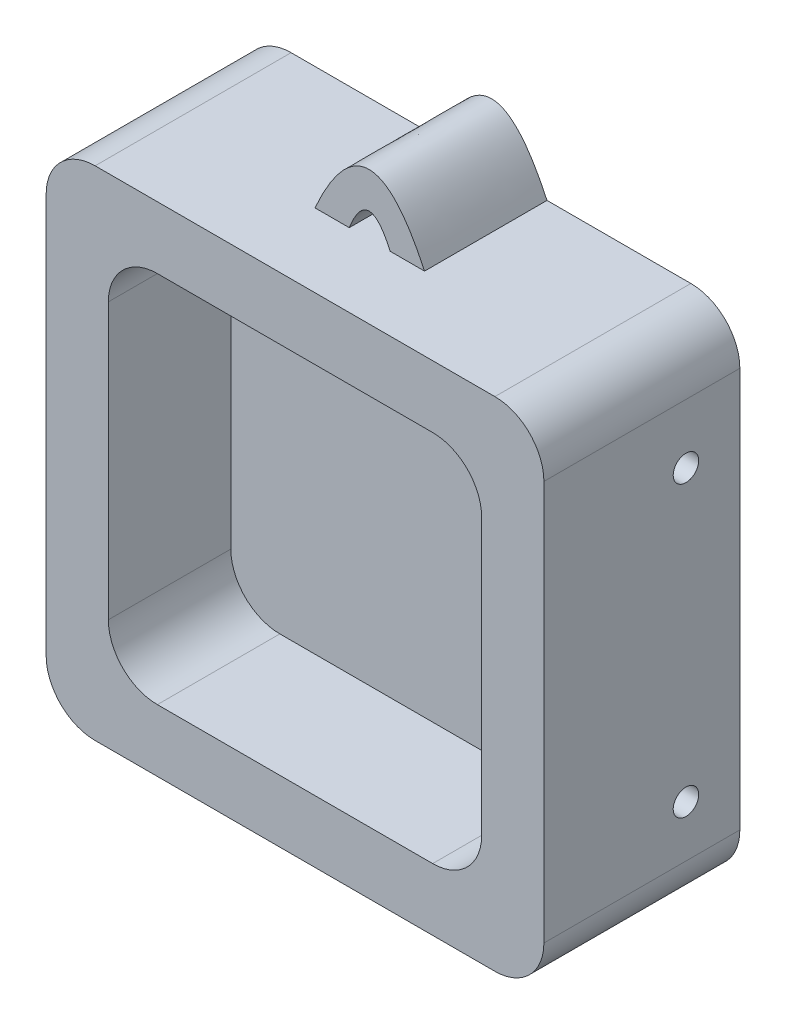
from build123d import *

# Parameters (mm, degrees)
SKETCH1_W          = 76.2
SKETCH1_H          = 76.2
SIDE_DEPTH         = 40
SKETCH1_8_W        = 76.2
SKETCH1_8_H        = 76.2
BOTTOM_DEPTH       = 15
HOLDER_DEPTH       = 25
FILLET1_R          = 10
FILLET2_R          = 10
FILLET3_R          = 10
FILLET4_R          = 10
SKETCH2_R          = 2.6
CUT_EXTRUDE1_DEPTH = 158.793298372
FILLET5_R          = 10
FILLET6_R          = 10
FILLET7_R          = 10
FILLET8_R          = 10


with BuildPart() as part:
    # Sketch1 → side (new body)
    with BuildSketch(Plane.XY):
        Polygon((0, 101.6), (0, 0), (101.6, 0), (101.6, 101.6), (62.237812333, 101.6), (55.237812333, 101.6), (46.872931824, 101.6), (39.872931824, 101.6), align=None)
        with Locations((50.8, 50.8)):
            Rectangle(SKETCH1_W, SKETCH1_H, mode=Mode.SUBTRACT)
    extrude(amount=SIDE_DEPTH)

    # Sketch1<8> → bottom (add)
    with BuildSketch(Plane.XY):
        with Locations((50.8, 50.8)):
            Rectangle(SKETCH1_8_W, SKETCH1_8_H)
    extrude(amount=BOTTOM_DEPTH)

    # Sketch1<10> → holder (add)
    with BuildSketch(Plane.XY):
        with BuildLine():
            add(Edge.make_bspline(
                [(39.872931824, 101.6), (50.775448556, 126.225942053), (62.237812333, 101.6)],
                knots=[0, 0, 0, 1, 1, 1], degree=2))
            Line((39.872931824, 101.6), (46.872931824, 101.6))
            add(Edge.make_bspline(
                [(46.872931824, 101.6), (50.757022912, 111.505038694), (55.237812333, 101.6)],
                knots=[0, 0, 0, 1, 1, 1], degree=2))
            Line((55.237812333, 101.6), (62.237812333, 101.6))
        make_face()
    extrude(amount=HOLDER_DEPTH)

    # Fillet1
    fillet1_edges = [part.edges().sort_by_distance(p)[0] for p in [
        (0, 101.6, 20),
    ]]
    fillet(fillet1_edges, radius=FILLET1_R)

    # Fillet2
    fillet2_edges = [part.edges().sort_by_distance(p)[0] for p in [
        (0, 0, 20),
    ]]
    fillet(fillet2_edges, radius=FILLET2_R)

    # Fillet3
    fillet3_edges = [part.edges().sort_by_distance(p)[0] for p in [
        (101.6, 0, 20),
    ]]
    fillet(fillet3_edges, radius=FILLET3_R)

    # Fillet4
    fillet4_edges = [part.edges().sort_by_distance(p)[0] for p in [
        (101.6, 101.6, 20),
    ]]
    fillet(fillet4_edges, radius=FILLET4_R)

    # Sketch2 → Cut-Extrude1 (cut, through all)
    with BuildSketch(Plane(origin=(101.6, 0, 0), x_dir=(0, 0, -1), z_dir=(1, 0, 0))):
        with Locations((-11, 79.49634719)):
            Circle(SKETCH2_R)
        with Locations((-11, 20.478079238)):
            Circle(SKETCH2_R)
    extrude(amount=-CUT_EXTRUDE1_DEPTH, mode=Mode.SUBTRACT)

    # Fillet5
    fillet5_edges = [part.edges().sort_by_distance(p)[0] for p in [
        (12.7, 88.9, 27.5),
    ]]
    fillet(fillet5_edges, radius=FILLET5_R)

    # Fillet6
    fillet6_edges = [part.edges().sort_by_distance(p)[0] for p in [
        (88.9, 88.9, 27.5),
    ]]
    fillet(fillet6_edges, radius=FILLET6_R)

    # Fillet7
    fillet7_edges = [part.edges().sort_by_distance(p)[0] for p in [
        (12.7, 12.7, 27.5),
    ]]
    fillet(fillet7_edges, radius=FILLET7_R)

    # Fillet8
    fillet8_edges = [part.edges().sort_by_distance(p)[0] for p in [
        (88.9, 12.7, 27.5),
    ]]
    fillet(fillet8_edges, radius=FILLET8_R)


solid = part.part
